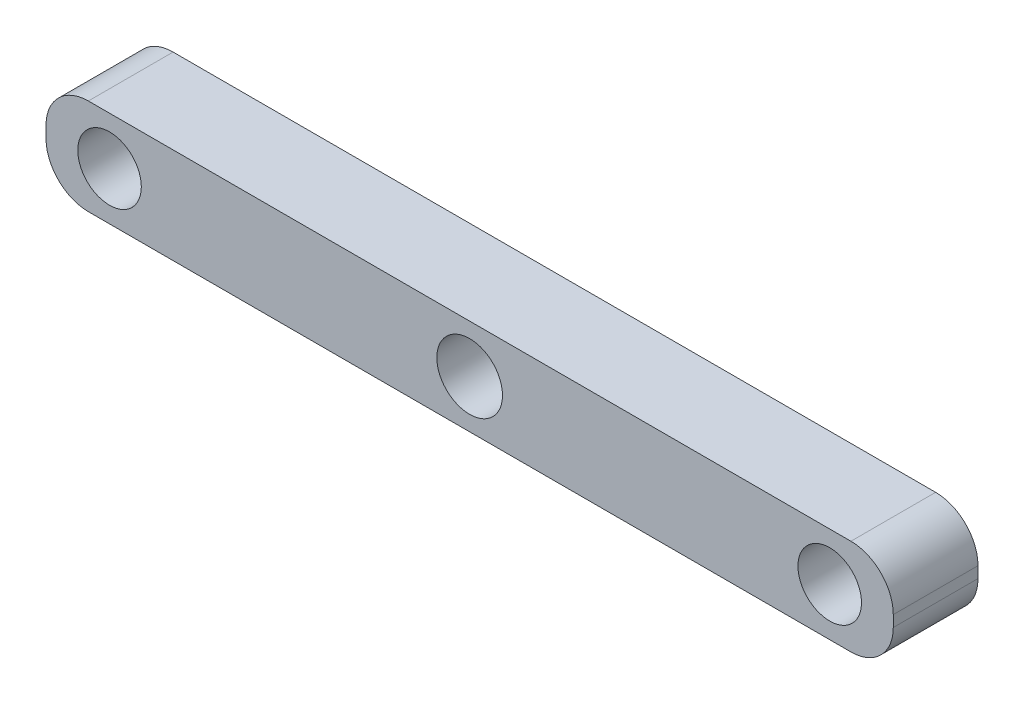
from build123d import *

# Parameters (mm, degrees)
SKETCH1_R           = 1.55
SKETCH1_R_2         = 1.5
BOSS_EXTRUDE1_DEPTH = 4


with BuildPart() as part:
    # Sketch1 → Boss-Extrude1 (new body)
    with BuildSketch(Plane.XY):
        with BuildLine():
            Line((-18, -2.263569898), (18, -2.263569898))
            ThreePointArc((18, -2.263569898), (19.414213562, -1.677783461), (20, -0.263569898))
            Line((20, -0.263569898), (20, 0.263569898))
            ThreePointArc((20, 0.263569898), (19.414213562, 1.677783461), (18, 2.263569898))
            Line((18, 2.263569898), (-18, 2.263569898))
            ThreePointArc((-18, 2.263569898), (-19.414213562, 1.677783461), (-20, 0.263569898))
            Line((-20, 0.263569898), (-20, -0.263569898))
            ThreePointArc((-20, -0.263569898), (-19.414213562, -1.677783461), (-18, -2.263569898))
        make_face()
        Circle(SKETCH1_R, mode=Mode.SUBTRACT)
        with Locations((-17, 0)):
            Circle(SKETCH1_R_2, mode=Mode.SUBTRACT)
        with Locations(Location((17, 0, 0), (0, 0, 180))):
            Circle(SKETCH1_R_2, mode=Mode.SUBTRACT)
    extrude(amount=BOSS_EXTRUDE1_DEPTH)


solid = part.part
